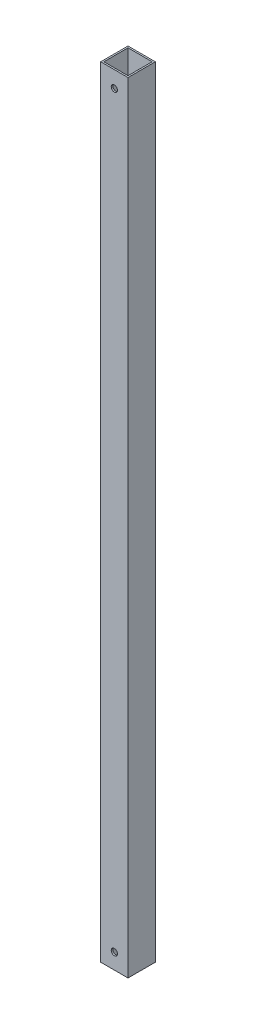
from build123d import *

# Parameters (mm, degrees)
CROQUIS1_W              = 35
CROQUIS1_H              = 35
CROQUIS1_W_2            = 31
CROQUIS1_H_2            = 31
SALIENTE_EXTRUIR1_DEPTH = 1000
CROQUIS2_R              = 4
CORTAR_EXTRUIR1_DEPTH   = 35
CROQUIS3_R              = 4
CORTAR_EXTRUIR2_DEPTH   = 35


with BuildPart() as part:
    # Croquis1 → Saliente-Extruir1 (new body)
    with BuildSketch(Plane(origin=(0, 0, 0), x_dir=(1, 0, 0), z_dir=(0, 1, 0))):
        with Locations((17.5, 17.5)):
            Rectangle(CROQUIS1_W, CROQUIS1_H)
        with Locations((17.5, 17.5)):
            Rectangle(CROQUIS1_W_2, CROQUIS1_H_2, mode=Mode.SUBTRACT)
    extrude(amount=SALIENTE_EXTRUIR1_DEPTH)

    # Croquis2 → Cortar-Extruir1 (cut)
    with BuildSketch(Plane.XY):
        with Locations((17.5, 20)):
            Circle(CROQUIS2_R)
    extrude(amount=-CORTAR_EXTRUIR1_DEPTH, mode=Mode.SUBTRACT)

    # Croquis3 → Cortar-Extruir2 (cut)
    with BuildSketch(Plane(origin=(0, 0, -35), x_dir=(-1, 0, 0), z_dir=(0, 0, -1))):
        with Locations((-17.5, 979)):
            Circle(CROQUIS3_R)
    extrude(amount=-CORTAR_EXTRUIR2_DEPTH, mode=Mode.SUBTRACT)


solid = part.part
